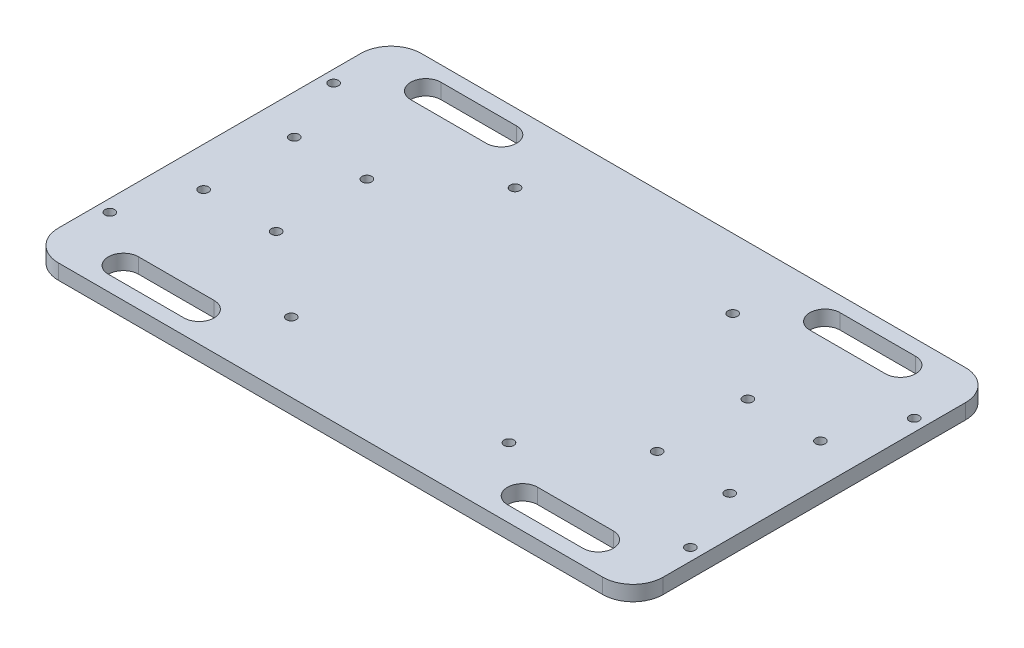
from build123d import *

# Parameters (mm, degrees)
SKETCH_2_W      = 200
SKETCH_2_H      = 120
SKETCH_2_R      = 1.6
EXTRUDE_1_DEPTH = 5
FILLET_1_R      = 10


with BuildPart() as part:
    # 草图2 → 凸台-拉伸1 (new body)
    with BuildSketch(Plane(origin=(0, 0, 0), x_dir=(1, 0, 0), z_dir=(0, 1, 0))):
        with Locations((100, 60)):
            Rectangle(SKETCH_2_W, SKETCH_2_H)
        with Locations(Location((187, 45, 0), (0, 0, 270))):
            Circle(SKETCH_2_R, mode=Mode.SUBTRACT)
        with Locations(Location((187, 75, 0), (0, 0, 90))):
            Circle(SKETCH_2_R, mode=Mode.SUBTRACT)
        with Locations(Location((163, 45, 0), (0, 0, 270))):
            Circle(SKETCH_2_R, mode=Mode.SUBTRACT)
        with Locations(Location((163, 75, 0), (0, 0, 90))):
            Circle(SKETCH_2_R, mode=Mode.SUBTRACT)
        with Locations(Location((13, 45, 0), (0, 0, 90))):
            Circle(SKETCH_2_R, mode=Mode.SUBTRACT)
        with Locations(Location((37, 45, 0), (0, 0, 90))):
            Circle(SKETCH_2_R, mode=Mode.SUBTRACT)
        with Locations(Location((13, 75, 0), (0, 0, 270))):
            Circle(SKETCH_2_R, mode=Mode.SUBTRACT)
        with Locations(Location((37, 75, 0), (0, 0, 270))):
            Circle(SKETCH_2_R, mode=Mode.SUBTRACT)
        with Locations(Location((196, 97, 0), (0, 0, 270))):
            Circle(SKETCH_2_R, mode=Mode.SUBTRACT)
        with Locations(Location((136, 97, 0), (0, 0, 270))):
            Circle(SKETCH_2_R, mode=Mode.SUBTRACT)
        with Locations(Location((196, 23, 0), (0, 0, 90))):
            Circle(SKETCH_2_R, mode=Mode.SUBTRACT)
        with Locations(Location((136, 23, 0), (0, 0, 90))):
            Circle(SKETCH_2_R, mode=Mode.SUBTRACT)
        with Locations(Location((4, 23, 0), (0, 0, 270))):
            Circle(SKETCH_2_R, mode=Mode.SUBTRACT)
        with Locations(Location((4, 97, 0), (0, 0, 90))):
            Circle(SKETCH_2_R, mode=Mode.SUBTRACT)
        with Locations(Location((64, 23, 0), (0, 0, 270))):
            Circle(SKETCH_2_R, mode=Mode.SUBTRACT)
        with Locations(Location((64, 97, 0), (0, 0, 90))):
            Circle(SKETCH_2_R, mode=Mode.SUBTRACT)
        with BuildLine():
            Line((153.5, 115), (178.5, 115))
            ThreePointArc((178.5, 115), (183.5, 110), (178.5, 105))
            Line((178.5, 105), (153.5, 105))
            ThreePointArc((153.5, 105), (148.5, 110), (153.5, 115))
        make_face(mode=Mode.SUBTRACT)
        with BuildLine():
            Line((153.5, 5), (178.5, 5))
            ThreePointArc((178.5, 5), (183.5, 10), (178.5, 15))
            Line((178.5, 15), (153.5, 15))
            ThreePointArc((153.5, 15), (148.5, 10), (153.5, 5))
        make_face(mode=Mode.SUBTRACT)
        with BuildLine():
            Line((46.5, 115), (21.5, 115))
            ThreePointArc((21.5, 115), (16.5, 110), (21.5, 105))
            Line((21.5, 105), (46.5, 105))
            ThreePointArc((46.5, 105), (51.5, 110), (46.5, 115))
        make_face(mode=Mode.SUBTRACT)
        with BuildLine():
            Line((46.5, 5), (21.5, 5))
            ThreePointArc((21.5, 5), (16.5, 10), (21.5, 15))
            Line((21.5, 15), (46.5, 15))
            ThreePointArc((46.5, 15), (51.5, 10), (46.5, 5))
        make_face(mode=Mode.SUBTRACT)
    extrude(amount=EXTRUDE_1_DEPTH)

    # 圆角1
    fillet_1_edges = [part.edges().sort_by_distance(p)[0] for p in [
        (0, 2.5, -120),
        (200, 2.5, -120),
        (200, 2.5, 0),
        (0, 2.5, 0),
    ]]
    fillet(fillet_1_edges, radius=FILLET_1_R)


solid = part.part
